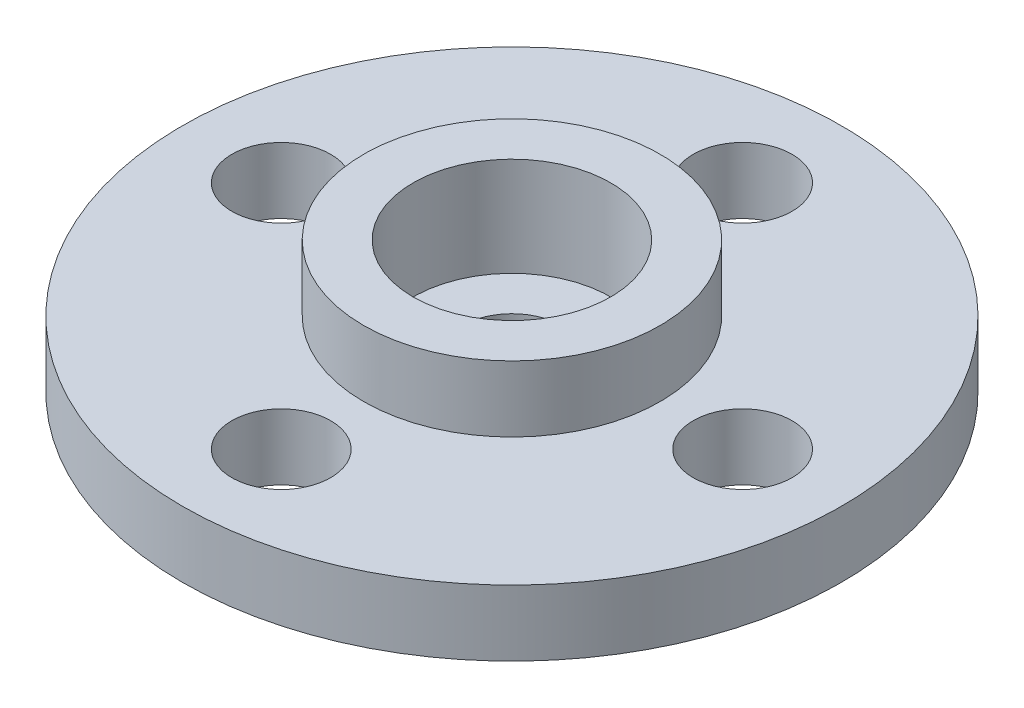
from build123d import *

# Parameters (mm, degrees)
SKETCH_1_R               = 10
EXTRUDE_351_DEPTH        = 2
SKETCH_2_R               = 4.5
EXTRUDE_436_DEPTH        = 2
SKETCH_3_R               = 3
CUT_EXTRUDE_526_DEPTH    = 3
SKETCH_4_R               = 1.5
CUT_EXTRUDE_623_DEPTH    = 15.456832295
SKETCH_5_R               = 1.5
CUT_EXTRUDE_727_DEPTH    = 15.282856857
PATTERN_CIRCULAR_1_COUNT = 4


with BuildPart() as part:
    # Эскиз1 → Extrude 351 (new body)
    with BuildSketch(Plane(origin=(0, 0, 0), x_dir=(1, 0, 0), z_dir=(0, 1, 0))):
        with Locations(Location((0, 0, 0), (0, 0, 270))):
            Circle(SKETCH_1_R)
    extrude(amount=EXTRUDE_351_DEPTH)

    # Эскиз2 → Extrude 436 (add)
    with BuildSketch(Plane(origin=(0, 2, 0), x_dir=(1, 0, 0), z_dir=(0, 1, 0))):
        with Locations(Location((0, 0, 0), (0, 0, 270))):
            Circle(SKETCH_2_R)
    extrude(amount=EXTRUDE_436_DEPTH)

    # Эскиз3 → Cut-Extrude 526 (cut)
    with BuildSketch(Plane(origin=(0, 4, 0), x_dir=(1, 0, 0), z_dir=(0, 1, 0))):
        with Locations(Location((0, 0, 0), (0, 0, 270))):
            Circle(SKETCH_3_R)
    extrude(amount=-CUT_EXTRUDE_526_DEPTH, mode=Mode.SUBTRACT)

    # Эскиз4 → Cut-Extrude 623 (cut, through all)
    with BuildSketch(Plane(origin=(0, 1, 0), x_dir=(1, 0, 0), z_dir=(0, 1, 0))):
        with Locations(Location((0, 0, 0), (0, 0, 270))):
            Circle(SKETCH_4_R)
    extrude(amount=-CUT_EXTRUDE_623_DEPTH, mode=Mode.SUBTRACT)

    # Эскиз5 → Cut-Extrude 727 (cut, through all)
    with BuildSketch(Plane(origin=(0, 2, 0), x_dir=(1, 0, 0), z_dir=(0, 1, 0))):
        with Locations(Location((7, 0, 0), (0, 0, 270))):
            Circle(SKETCH_5_R)
    cut_extrude_727 = extrude(amount=-CUT_EXTRUDE_727_DEPTH, mode=Mode.SUBTRACT)

    # Круговой массив1: Cut-Extrude 727 ×4 about axis
    pattern_circular_1_axis = Axis((0, 0, 0), (0, 1, 0))
    for i in range(1, PATTERN_CIRCULAR_1_COUNT):
        add(cut_extrude_727.rotate(pattern_circular_1_axis, i * 360 / PATTERN_CIRCULAR_1_COUNT), mode=Mode.SUBTRACT)


solid = part.part
